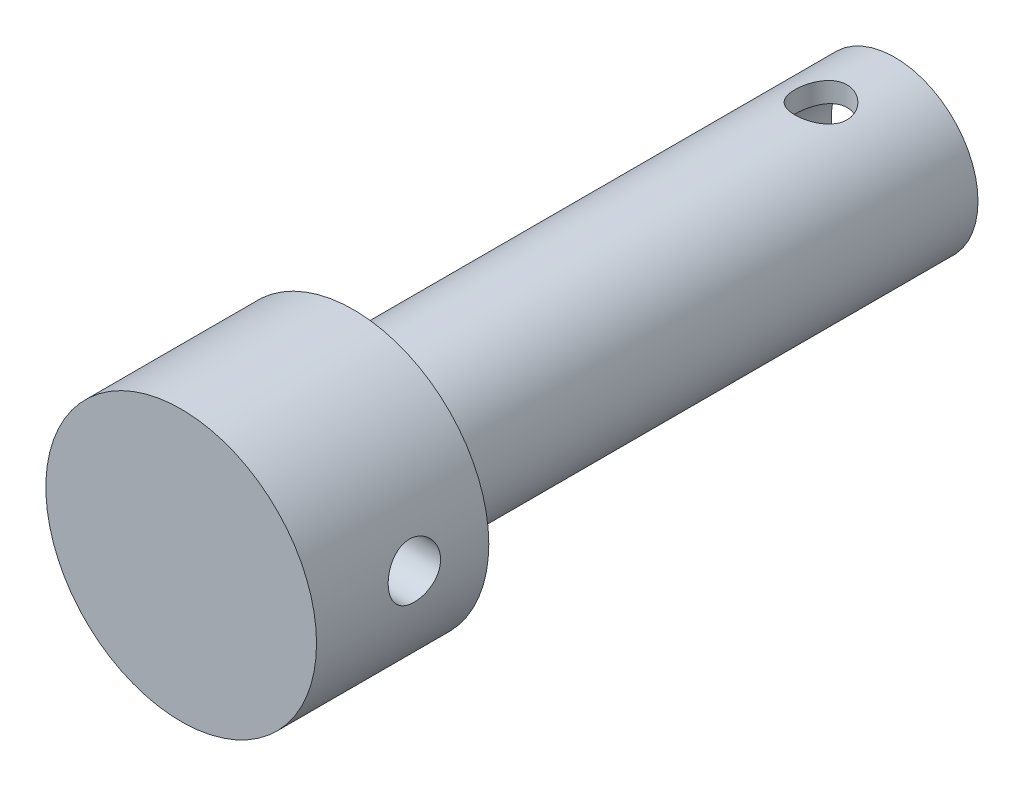
from build123d import *

# Parameters (mm, degrees)
SKETCH1_R               = 10.7315
SKETCH1_R_2             = 8.1915
BOSS_EXTRUDE1_DEPTH     = 88.9
SKETCH4_R               = 17.4625
BOSS_EXTRUDE2_DEPTH     = 19.05
CUT_EXTRUDE1_DEPTH      = 93.266395901
CUT_EXTRUDE1_DEPTH_BACK = 93.266395901
SKETCH5_R               = 3.3655
CUT_EXTRUDE2_DEPTH      = 93.266396035
CUT_EXTRUDE2_DEPTH_BACK = 93.266396035
SKETCH7_R               = 3.3655
SKETCH8_R               = 8.1915
CUT_EXTRUDE3_DEPTH      = 93.266396035
BOSS_EXTRUDE3_START     = 3.175
SKETCH9_R               = 17.4625
BOSS_EXTRUDE3_DEPTH     = 3.175


with BuildPart() as part:
    # Sketch1 → Boss-Extrude1 (new body)
    with BuildSketch(Plane.XY):
        Circle(SKETCH1_R)
        Circle(SKETCH1_R_2, mode=Mode.SUBTRACT)
    extrude(amount=BOSS_EXTRUDE1_DEPTH)

    # Sketch4 → Boss-Extrude2 (add)
    with BuildSketch(Plane.XY.offset(88.9)):
        Circle(SKETCH4_R)
    extrude(amount=-BOSS_EXTRUDE2_DEPTH)

    # Sketch5 → Cut-Extrude1 (cut, two sides: drawn at the far end of the back side and taken through both)
    with BuildSketch(Plane(origin=(0, 0, 0), x_dir=(0, 0, -1), z_dir=(1, 0, 0)).offset(-CUT_EXTRUDE1_DEPTH_BACK)):
        with Locations(Location((-79.375, 1.5875, 0), (0, 0, 331.855418691))):
            Circle(SKETCH5_R)
    extrude(amount=CUT_EXTRUDE1_DEPTH + CUT_EXTRUDE1_DEPTH_BACK, mode=Mode.SUBTRACT)

    # Sketch7 → Cut-Extrude2 (cut, two sides: drawn at the far end of the back side and taken through both)
    with BuildSketch(Plane(origin=(0, 0, 0), x_dir=(1, 0, 0), z_dir=(0, 1, 0)).offset(-CUT_EXTRUDE2_DEPTH_BACK)):
        with Locations(Location((0, -9.525, 0), (0, 0, 270))):
            Circle(SKETCH7_R)
    extrude(amount=CUT_EXTRUDE2_DEPTH + CUT_EXTRUDE2_DEPTH_BACK, mode=Mode.SUBTRACT)

    # Sketch8 → Cut-Extrude3 (cut, through all)
    with BuildSketch(Plane.XY.offset(88.9)):
        Circle(SKETCH8_R)
    extrude(amount=-CUT_EXTRUDE3_DEPTH, mode=Mode.SUBTRACT)

    # Sketch9 → Boss-Extrude3 (add)
    with BuildSketch(Plane.XY.offset(88.9).offset(BOSS_EXTRUDE3_START)):
        Circle(SKETCH9_R)
    extrude(amount=-BOSS_EXTRUDE3_DEPTH)


solid = part.part
